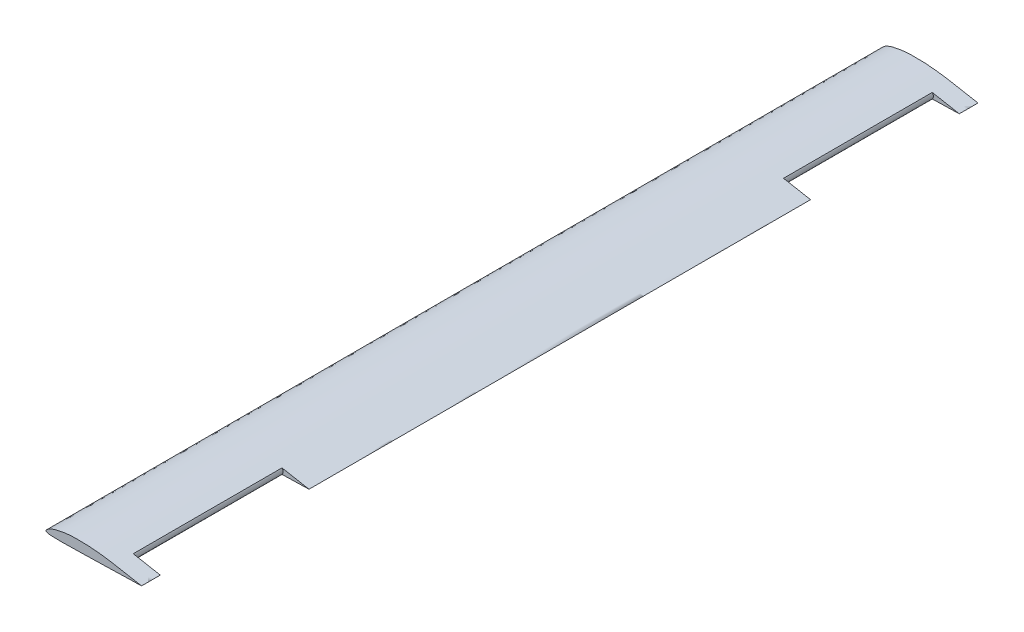
from build123d import *

# Parameters (mm, degrees)
BOSS_EXTRUDE1_DEPTH = 875
SKETCH2_W           = 80.760580462
SKETCH2_H           = 108.55553294
BOSS_EXTRUDE2_DEPTH = 10
SKETCH3_W           = 74.562270492
SKETCH3_H           = 43.476270514
BOSS_EXTRUDE3_DEPTH = 10
SKETCH4_W           = 56.548116249
SKETCH4_H           = 311.192527761
CUT_EXTRUDE1_DEPTH  = 888.936475467
BOSS_EXTRUDE4_DEPTH = 311.192527761
BOSS_EXTRUDE5_DEPTH = 311.192527761


with BuildPart() as part:
    # Sketch1 → Boss-Extrude1 (new, symmetric)
    with BuildSketch(Plane.XY):
        with BuildLine():
            add(Edge.make_bspline(
                [(150, 0), (149.999685432, 0.011137501), (149.185629686, 0.079599271), (148.362349609, 0.23854718), (146.383595891, 0.535828379), (143.975549334, 0.962808352), (140.845175163, 1.509100839), (137.157536262, 2.176029136), (132.907625451, 2.969281671), (128.156422521, 3.873961727), (122.950049785, 4.887860135), (117.339343888, 5.98461827), (111.379456374, 7.15084592), (105.122384646, 8.362662885), (98.604061548, 9.566419981), (91.857920469, 10.727303622), (84.924222345, 11.862484255), (77.836652116, 12.928359051), (70.638845299, 13.915157923), (63.371696052, 14.820144), (56.068248712, 15.599623663), (48.769465666, 16.270561295), (41.508506197, 16.804574125), (34.324968703, 17.187593756), (27.252542914, 17.43744655), (20.325402615, 17.524130752), (13.578234797, 17.453738953), (7.041829916, 17.231221238), (0.744139078, 16.842790145), (-5.28706646, 16.302437679), (-11.026056632, 15.619187543), (-16.442874069, 14.785962894), (-21.518953841, 13.836701958), (-26.230367257, 12.76343092), (-30.557255547, 11.585522165), (-34.484037063, 10.323714507), (-37.992816268, 8.989600554), (-41.073498091, 7.611551682), (-43.71302097, 6.207732839), (-45.901320793, 4.798740069), (-47.631161772, 3.43292398), (-48.918728294, 2.122328801), (-49.680148605, 0.959925724), (-50.148351933, -0.155072165), (-49.524268162, -1.166960599), (-48.362619911, -1.842209025), (-46.664951951, -2.485494088), (-44.363101536, -2.94989849), (-41.451092055, -3.278688246), (-37.931028928, -3.546816469), (-33.824873936, -3.768109302), (-29.158463644, -3.887986788), (-23.965830731, -3.996914377), (-18.282701864, -4.023703652), (-12.151188536, -4.032477259), (-5.613822936, -3.96084977), (1.293896963, -3.870928981), (8.534096681, -3.696783666), (16.066850289, -3.521047337), (23.840215919, -3.321283964), (31.79996501, -3.098849108), (39.887632236, -2.872363015), (48.047003627, -2.686479416), (56.216688855, -2.460792702), (64.343672436, -2.234090406), (72.373777077, -2.050144318), (80.253746259, -1.817291305), (87.935095991, -1.617201779), (95.364484114, -1.451918417), (102.478479779, -1.239703786), (109.216521507, -1.061304167), (115.543555003, -0.907638554), (121.451776676, -0.740946355), (126.933447967, -0.601572319), (131.952049659, -0.486330374), (136.45473162, -0.371062991), (140.368394028, -0.240535843), (143.692337232, -0.16069725), (146.24026167, -0.117578972), (148.313210121, -0.035134836), (149.167754934, -0.030878354), (150.000317632, -0.011245986), (150, 0)],
                knots=[0, 0, 0, 0, 0.000950607, 0.003756507, 0.008317118, 0.014521534, 0.022293258, 0.031559824, 0.042220752, 0.054150955, 0.067231026, 0.081331038, 0.096307423, 0.112011952, 0.128327294, 0.145184499, 0.162487629, 0.180135525, 0.198033488, 0.216058829, 0.234134495, 0.252191782, 0.270104077, 0.287817033, 0.305234681, 0.322284448, 0.338896329, 0.354986109, 0.370505848, 0.385416956, 0.399632136, 0.413115968, 0.42582253, 0.437703697, 0.448737409, 0.458879724, 0.468105333, 0.476404612, 0.483748471, 0.49013386, 0.495557186, 0.500011534, 0.503516098, 0.506001286, 0.508215361, 0.511493607, 0.515843652, 0.521547383, 0.528754592, 0.537448665, 0.547575188, 0.55907379, 0.571867409, 0.585873248, 0.600979911, 0.617080267, 0.634081341, 0.651920682, 0.670483603, 0.689642387, 0.709259499, 0.729200941, 0.749303287, 0.769441295, 0.789466278, 0.8092541, 0.828669736, 0.847597548, 0.865914743, 0.883466594, 0.900078509, 0.915617835, 0.930134998, 0.943663107, 0.956049855, 0.967158865, 0.976852657, 0.984995817, 0.991471781, 0.996183553, 0.999040133, 1, 1, 1, 1], degree=3))
        make_face()
    extrude(amount=BOSS_EXTRUDE1_DEPTH, both=True)

    # Sketch2 → Boss-Extrude2 (add)
    with BuildSketch(Plane(origin=(0, 0, 0), x_dir=(1, 0, 0), z_dir=(0, 1, 0))):
        Rectangle(SKETCH2_W, SKETCH2_H)
    extrude(amount=-BOSS_EXTRUDE2_DEPTH)

    # Sketch3 → Boss-Extrude3 (add)
    with BuildSketch(Plane(origin=(0, 0, 0), x_dir=(1, 0, 0), z_dir=(0, 1, 0))):
        with Locations((0, 400)):
            Rectangle(SKETCH3_W, SKETCH3_H)
    boss_extrude3 = extrude(amount=-BOSS_EXTRUDE3_DEPTH)

    # Mirror1: Boss-Extrude3 across plane
    add(boss_extrude3.mirror(Plane.XY))

    # Sketch4 → Cut-Extrude1 (cut, symmetric)
    with BuildSketch(Plane(origin=(0, 0, 0), x_dir=(1, 0, 0), z_dir=(0, 1, 0))):
        with Locations((121.725942237, 680.281339757)):
            Rectangle(SKETCH4_W, SKETCH4_H)
    cut_extrude1 = extrude(amount=CUT_EXTRUDE1_DEPTH, both=True, mode=Mode.SUBTRACT)

    # Mirror2: Cut-Extrude1 across plane
    add(cut_extrude1.mirror(Plane.XY), mode=Mode.SUBTRACT)

    # Sketch5 → Boss-Extrude4 (add)
    with BuildSketch(Plane.XY.offset(524.685075876)):
        with BuildLine():
            Line((93.451884112, 10.448546174), (93.451884112, -1.490829551))
            ThreePointArc((93.451884112, -1.490829551), (95.924609788, 4.478858311), (93.451884112, 10.448546174))
        make_face()
    extrude(amount=BOSS_EXTRUDE4_DEPTH)

    # Sketch6 → Boss-Extrude5 (add)
    with BuildSketch(Plane.XY.offset(-835.877603637)):
        with BuildLine():
            Line((93.451884112, 10.448546174), (93.451884112, -1.490829551))
            ThreePointArc((93.451884112, -1.490829551), (95.924609788, 4.478858311), (93.451884112, 10.448546174))
        make_face()
    extrude(amount=BOSS_EXTRUDE5_DEPTH)


solid = part.part
